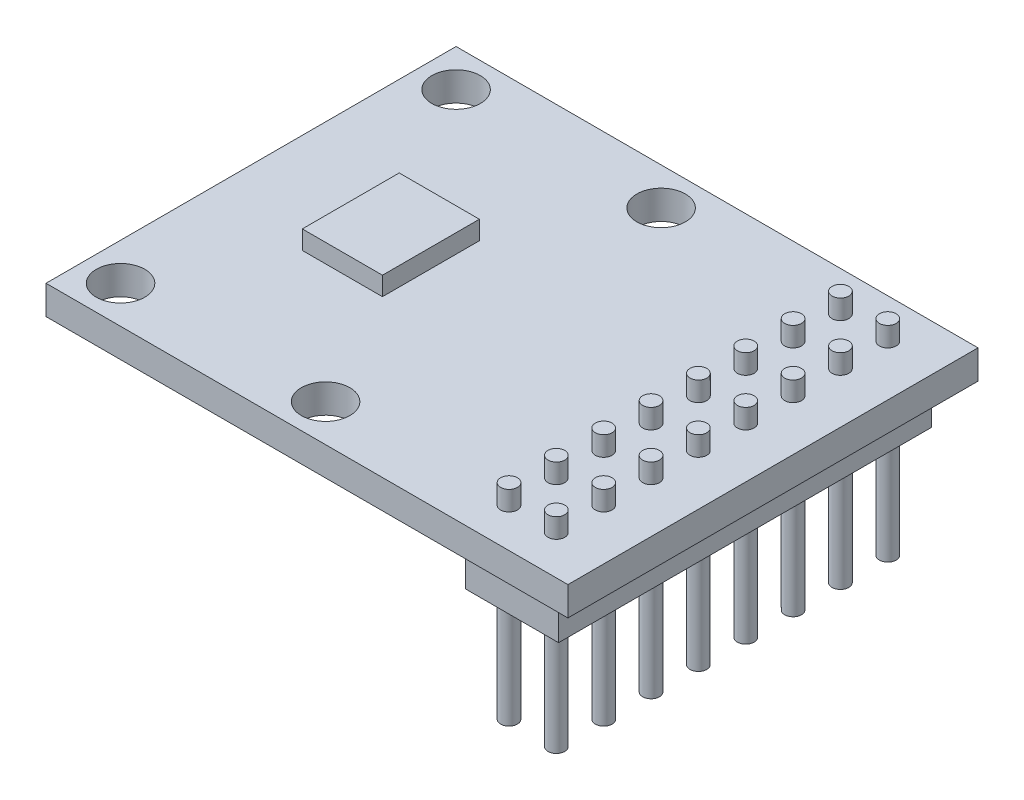
from build123d import *

# Parameters (mm, degrees)
SKETCH1_W               = 15
SKETCH1_H               = 22
SKETCH1_R               = 1.3
SKETCH1_R_2             = 0.5
BOSS_EXTRUDE1_DEPTH     = 1.55
SKETCH2_W               = 4.3
SKETCH2_H               = 5.2
BOSS_EXTRUDE2_DEPTH     = 1
SKETCH4_W               = 22
SKETCH4_H               = 1.55
BOSS_EXTRUDE3_DEPTH     = 13
SKETCH6_W               = 5
SKETCH6_H               = 20
BOSS_EXTRUDE4_DEPTH     = 2.4
BOSS_EXTRUDE5_START     = -5
SKETCH7_R               = 0.45
BOSS_EXTRUDE5_DEPTH     = 11
LPATTERN1_COUNT         = 4
LPATTERN1_PITCH         = 2.54
LPATTERN1_COUNT_DIR2    = 2
LPATTERN1_PITCH_DIR2    = 2.54
MIRROR1_START           = -5
MIRROR1_COPY_1_SKETCH_R = 0.45
MIRROR1_COPY_1_DEPTH    = 11
MIRROR1_COPY_2_SKETCH_R = 0.45
MIRROR1_COPY_2_DEPTH    = 11
MIRROR1_COPY_3_SKETCH_R = 0.45
MIRROR1_COPY_3_DEPTH    = 11
MIRROR1_COPY_4_SKETCH_R = 0.45
MIRROR1_COPY_4_DEPTH    = 11
MIRROR1_COPY_5_SKETCH_R = 0.45
MIRROR1_COPY_5_DEPTH    = 11
MIRROR1_COPY_6_SKETCH_R = 0.45
MIRROR1_COPY_6_DEPTH    = 11
MIRROR1_COPY_7_SKETCH_R = 0.45
MIRROR1_COPY_7_DEPTH    = 11


with BuildPart() as part:
    # Sketch1 → Boss-Extrude1 (new body)
    with BuildSketch(Plane(origin=(0, 0, 0), x_dir=(1, 0, 0), z_dir=(0, 1, 0))):
        Rectangle(SKETCH1_W, SKETCH1_H)
        with Locations(Location((-5.5, 9, 0), (0, 0, 90))):
            Circle(SKETCH1_R, mode=Mode.SUBTRACT)
        with Locations(Location((5.5, 9, 0), (0, 0, 90))):
            Circle(SKETCH1_R, mode=Mode.SUBTRACT)
        with Locations(Location((5.5, -9, 0), (0, 0, 90))):
            Circle(SKETCH1_R, mode=Mode.SUBTRACT)
        with Locations(Location((-5.5, -9, 0), (0, 0, 90))):
            Circle(SKETCH1_R, mode=Mode.SUBTRACT)
        with Locations(Location((0, 0, 0), (0, 0, 270))):
            Circle(SKETCH1_R_2, mode=Mode.SUBTRACT)
    extrude(amount=BOSS_EXTRUDE1_DEPTH)

    # Sketch2 → Boss-Extrude2 (add)
    with BuildSketch(Plane(origin=(0, 1.55, 0), x_dir=(1, 0, 0), z_dir=(0, 1, 0))):
        Rectangle(SKETCH2_W, SKETCH2_H)
    extrude(amount=BOSS_EXTRUDE2_DEPTH)

    # Sketch4 → Boss-Extrude3 (add)
    with BuildSketch(Plane(origin=(7.5, 0, 0), x_dir=(0, 0, -1), z_dir=(1, 0, 0))):
        with Locations((0, 0.775)):
            Rectangle(SKETCH4_W, SKETCH4_H)
    extrude(amount=BOSS_EXTRUDE3_DEPTH)

    # Sketch6 → Boss-Extrude4 (add)
    with BuildSketch(Plane.XZ):
        with Locations((16.5, 0)):
            Rectangle(SKETCH6_W, SKETCH6_H)
    extrude(amount=BOSS_EXTRUDE4_DEPTH)

    # Sketch7 → Boss-Extrude5 (add)
    with BuildSketch(Plane.XZ.offset(2.4).offset(BOSS_EXTRUDE5_START)):
        with Locations(Location((15.23, 1.27, 0), (0, 0, 270))):
            Circle(SKETCH7_R)
    boss_extrude5 = extrude(amount=BOSS_EXTRUDE5_DEPTH)

    # LPattern1: Boss-Extrude5 4 × 2
    with Locations(*[(j * LPATTERN1_PITCH_DIR2, 0, i * LPATTERN1_PITCH) for i in range(LPATTERN1_COUNT) for j in range(LPATTERN1_COUNT_DIR2) if (i, j) != (0, 0)]):
        add(boss_extrude5)

    # Mirror1: Boss-Extrude5 across plane
    add(boss_extrude5.mirror(Plane.XY))

    # Mirror1 copy 1 sketch → Mirror1 copy 1 (add)
    with BuildSketch(Plane(origin=(2.54, -2.4, 0), x_dir=(1, 0, 0), z_dir=(0, -1, 0)).offset(MIRROR1_START)):
        with Locations((15.23, -1.27)):
            Circle(MIRROR1_COPY_1_SKETCH_R)
    extrude(amount=MIRROR1_COPY_1_DEPTH)

    # Mirror1 copy 2 sketch → Mirror1 copy 2 (add)
    with BuildSketch(Plane(origin=(0, -2.4, -2.54), x_dir=(1, 0, 0), z_dir=(0, -1, 0)).offset(MIRROR1_START)):
        with Locations((15.23, -1.27)):
            Circle(MIRROR1_COPY_2_SKETCH_R)
    extrude(amount=MIRROR1_COPY_2_DEPTH)

    # Mirror1 copy 3 sketch → Mirror1 copy 3 (add)
    with BuildSketch(Plane(origin=(2.54, -2.4, -2.54), x_dir=(1, 0, 0), z_dir=(0, -1, 0)).offset(MIRROR1_START)):
        with Locations((15.23, -1.27)):
            Circle(MIRROR1_COPY_3_SKETCH_R)
    extrude(amount=MIRROR1_COPY_3_DEPTH)

    # Mirror1 copy 4 sketch → Mirror1 copy 4 (add)
    with BuildSketch(Plane(origin=(0, -2.4, -5.08), x_dir=(1, 0, 0), z_dir=(0, -1, 0)).offset(MIRROR1_START)):
        with Locations((15.23, -1.27)):
            Circle(MIRROR1_COPY_4_SKETCH_R)
    extrude(amount=MIRROR1_COPY_4_DEPTH)

    # Mirror1 copy 5 sketch → Mirror1 copy 5 (add)
    with BuildSketch(Plane(origin=(2.54, -2.4, -5.08), x_dir=(1, 0, 0), z_dir=(0, -1, 0)).offset(MIRROR1_START)):
        with Locations((15.23, -1.27)):
            Circle(MIRROR1_COPY_5_SKETCH_R)
    extrude(amount=MIRROR1_COPY_5_DEPTH)

    # Mirror1 copy 6 sketch → Mirror1 copy 6 (add)
    with BuildSketch(Plane(origin=(0, -2.4, -7.62), x_dir=(1, 0, 0), z_dir=(0, -1, 0)).offset(MIRROR1_START)):
        with Locations((15.23, -1.27)):
            Circle(MIRROR1_COPY_6_SKETCH_R)
    extrude(amount=MIRROR1_COPY_6_DEPTH)

    # Mirror1 copy 7 sketch → Mirror1 copy 7 (add)
    with BuildSketch(Plane(origin=(2.54, -2.4, -7.62), x_dir=(1, 0, 0), z_dir=(0, -1, 0)).offset(MIRROR1_START)):
        with Locations((15.23, -1.27)):
            Circle(MIRROR1_COPY_7_SKETCH_R)
    extrude(amount=MIRROR1_COPY_7_DEPTH)


solid = part.part
